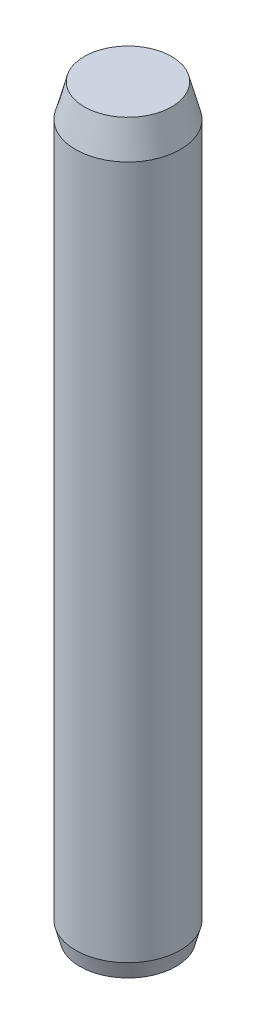
from build123d import *

# Parameters (mm, degrees)
SKETCH1_R           = 12
BOSS_EXTRUDE1_DEPTH = 170
CHAMFER1_SIZE       = 2
CHAMFER1_SIZE2      = 7.464101615
CHAMFER2_SIZE       = 1
CHAMFER2_SIZE2      = 3.732050808


with BuildPart() as part:
    # Sketch1 → Boss-Extrude1 (new body)
    with BuildSketch(Plane(origin=(0, 0, 0), x_dir=(1, 0, 0), z_dir=(0, 1, 0))):
        with Locations(Location((0, 0, 0), (0, 0, 270))):
            Circle(SKETCH1_R)
    extrude(amount=BOSS_EXTRUDE1_DEPTH)

    # Chamfer1
    chamfer1_edges = [part.edges().sort_by_distance(p)[0] for p in [
        (0, 170, -12),
    ]]
    chamfer1_side = [part.faces().sort_by_distance(p)[0] for p in [
        (0, 170, 0),
    ]]
    chamfer(chamfer1_edges, length=CHAMFER1_SIZE, length2=CHAMFER1_SIZE2, reference=chamfer1_side[0])

    # Chamfer2
    chamfer2_edges = [part.edges().sort_by_distance(p)[0] for p in [
        (0, 0, -12),
    ]]
    chamfer2_side = [part.faces().sort_by_distance(p)[0] for p in [
        (0, 0, 0),
    ]]
    chamfer(chamfer2_edges, length=CHAMFER2_SIZE, length2=CHAMFER2_SIZE2, reference=chamfer2_side[0])


solid = part.part
